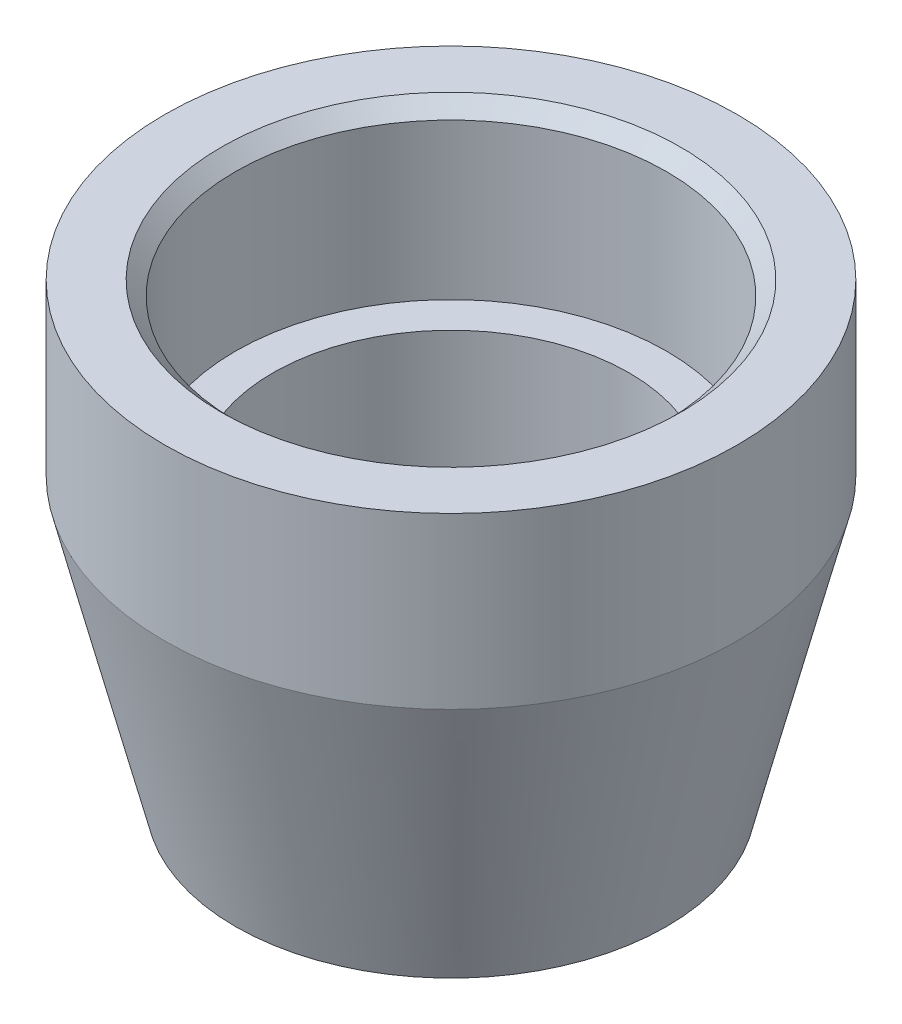
from build123d import *

# Parameters (mm, degrees)
CHAMFER1_SIZE = 0.2


with BuildPart() as part:
    # Sketch1 → Revolve1 (revolve)
    with BuildSketch(Plane.XY, mode=Mode.PRIVATE) as revolve1_sk:
        Polygon((2.52, 0), (2.52, 4), (3.05, 4), (3.05, 6.4), (4.05, 6.4), (4.05, 4), (3.05, 0), align=None)
    revolve(revolve1_sk.sketch.rotate(Axis((0, 0, 0), (0, 1, 0)), 90), axis=Axis((0, 0, 0), (0, 1, 0)))

    # Chamfer1
    chamfer1_edges = [part.edges().sort_by_distance(p)[0] for p in [
        (0, 6.4, 3.05),
    ]]
    chamfer(chamfer1_edges, length=CHAMFER1_SIZE)


solid = part.part
